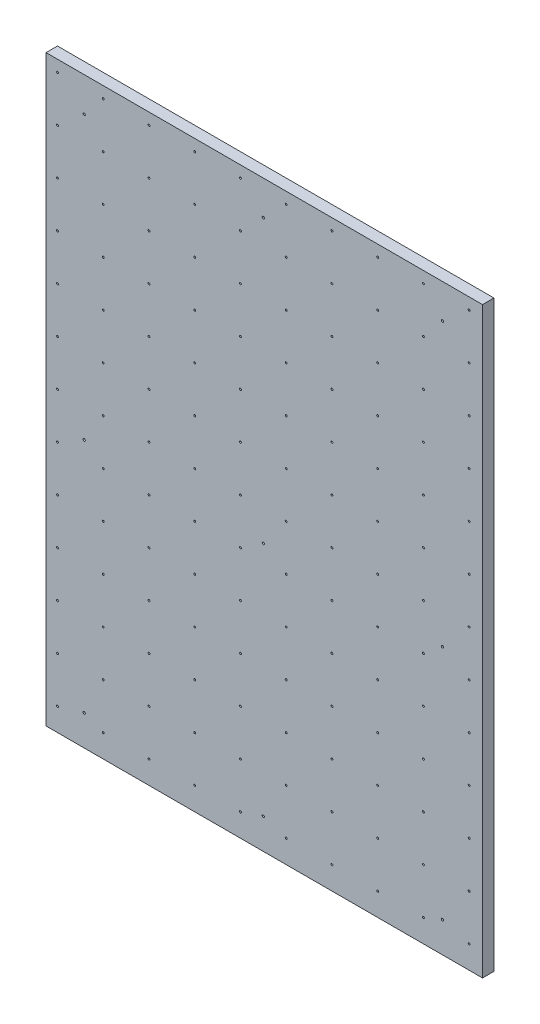
from build123d import *

# Parameters (mm, degrees)
SKETCH_1_W          = 1145
SKETCH_1_H          = 1530
EXTRUDE_1_DEPTH     = 15
SKETCH_2_R          = 2.5
CUT_EXTRUDE_1_DEPTH = 956.971364634
SKETCH_3_R          = 3
CUT_EXTRUDE_2_DEPTH = 956.971364634


with BuildPart() as part:
    # Эскиз1 → Бобышка-Вытянуть1 (new, symmetric)
    with BuildSketch(Plane.XY):
        Rectangle(SKETCH_1_W, SKETCH_1_H)
    extrude(amount=EXTRUDE_1_DEPTH, both=True)

    # Эскиз2 → Вырез-Вытянуть1 (cut, through all)
    with BuildSketch(Plane.XY.offset(15)):
        with Locations((-542.5, 735)):
            Circle(SKETCH_2_R)
        with Locations((-422.5, 735)):
            Circle(SKETCH_2_R)
        with Locations((-302.5, 735)):
            Circle(SKETCH_2_R)
        with Locations((-182.5, 735)):
            Circle(SKETCH_2_R)
        with Locations((-62.5, 735)):
            Circle(SKETCH_2_R)
        with Locations((57.5, 735)):
            Circle(SKETCH_2_R)
        with Locations((177.5, 735)):
            Circle(SKETCH_2_R)
        with Locations((297.5, 735)):
            Circle(SKETCH_2_R)
        with Locations((417.5, 735)):
            Circle(SKETCH_2_R)
        with Locations((537.5, 735)):
            Circle(SKETCH_2_R)
        with Locations((-422.5, 615)):
            Circle(SKETCH_2_R)
        with Locations((-302.5, 615)):
            Circle(SKETCH_2_R)
        with Locations((-182.5, 615)):
            Circle(SKETCH_2_R)
        with Locations((-62.5, 615)):
            Circle(SKETCH_2_R)
        with Locations((57.5, 615)):
            Circle(SKETCH_2_R)
        with Locations((177.5, 615)):
            Circle(SKETCH_2_R)
        with Locations((297.5, 615)):
            Circle(SKETCH_2_R)
        with Locations((417.5, 615)):
            Circle(SKETCH_2_R)
        with Locations((537.5, 615)):
            Circle(SKETCH_2_R)
        with Locations((-422.5, 495)):
            Circle(SKETCH_2_R)
        with Locations((-302.5, 495)):
            Circle(SKETCH_2_R)
        with Locations((-182.5, 495)):
            Circle(SKETCH_2_R)
        with Locations((-62.5, 495)):
            Circle(SKETCH_2_R)
        with Locations((57.5, 495)):
            Circle(SKETCH_2_R)
        with Locations((177.5, 495)):
            Circle(SKETCH_2_R)
        with Locations((297.5, 495)):
            Circle(SKETCH_2_R)
        with Locations((417.5, 495)):
            Circle(SKETCH_2_R)
        with Locations((537.5, 495)):
            Circle(SKETCH_2_R)
        with Locations((-422.5, 375)):
            Circle(SKETCH_2_R)
        with Locations((-302.5, 375)):
            Circle(SKETCH_2_R)
        with Locations((-182.5, 375)):
            Circle(SKETCH_2_R)
        with Locations((-62.5, 375)):
            Circle(SKETCH_2_R)
        with Locations((57.5, 375)):
            Circle(SKETCH_2_R)
        with Locations((177.5, 375)):
            Circle(SKETCH_2_R)
        with Locations((297.5, 375)):
            Circle(SKETCH_2_R)
        with Locations((417.5, 375)):
            Circle(SKETCH_2_R)
        with Locations((537.5, 375)):
            Circle(SKETCH_2_R)
        with Locations((-422.5, 255)):
            Circle(SKETCH_2_R)
        with Locations((-302.5, 255)):
            Circle(SKETCH_2_R)
        with Locations((-182.5, 255)):
            Circle(SKETCH_2_R)
        with Locations((-62.5, 255)):
            Circle(SKETCH_2_R)
        with Locations((57.5, 255)):
            Circle(SKETCH_2_R)
        with Locations((177.5, 255)):
            Circle(SKETCH_2_R)
        with Locations((297.5, 255)):
            Circle(SKETCH_2_R)
        with Locations((417.5, 255)):
            Circle(SKETCH_2_R)
        with Locations((537.5, 255)):
            Circle(SKETCH_2_R)
        with Locations((-422.5, 135)):
            Circle(SKETCH_2_R)
        with Locations((-302.5, 135)):
            Circle(SKETCH_2_R)
        with Locations((-182.5, 135)):
            Circle(SKETCH_2_R)
        with Locations((-62.5, 135)):
            Circle(SKETCH_2_R)
        with Locations((57.5, 135)):
            Circle(SKETCH_2_R)
        with Locations((177.5, 135)):
            Circle(SKETCH_2_R)
        with Locations((297.5, 135)):
            Circle(SKETCH_2_R)
        with Locations((417.5, 135)):
            Circle(SKETCH_2_R)
        with Locations((537.5, 135)):
            Circle(SKETCH_2_R)
        with Locations((-422.5, 15)):
            Circle(SKETCH_2_R)
        with Locations((-302.5, 15)):
            Circle(SKETCH_2_R)
        with Locations((-182.5, 15)):
            Circle(SKETCH_2_R)
        with Locations((-62.5, 15)):
            Circle(SKETCH_2_R)
        with Locations((57.5, 15)):
            Circle(SKETCH_2_R)
        with Locations((177.5, 15)):
            Circle(SKETCH_2_R)
        with Locations((297.5, 15)):
            Circle(SKETCH_2_R)
        with Locations((417.5, 15)):
            Circle(SKETCH_2_R)
        with Locations((537.5, 15)):
            Circle(SKETCH_2_R)
        with Locations((-422.5, -105)):
            Circle(SKETCH_2_R)
        with Locations((-302.5, -105)):
            Circle(SKETCH_2_R)
        with Locations((-182.5, -105)):
            Circle(SKETCH_2_R)
        with Locations((-62.5, -105)):
            Circle(SKETCH_2_R)
        with Locations((57.5, -105)):
            Circle(SKETCH_2_R)
        with Locations((177.5, -105)):
            Circle(SKETCH_2_R)
        with Locations((297.5, -105)):
            Circle(SKETCH_2_R)
        with Locations((417.5, -105)):
            Circle(SKETCH_2_R)
        with Locations((537.5, -105)):
            Circle(SKETCH_2_R)
        with Locations((-422.5, -225)):
            Circle(SKETCH_2_R)
        with Locations((-302.5, -225)):
            Circle(SKETCH_2_R)
        with Locations((-182.5, -225)):
            Circle(SKETCH_2_R)
        with Locations((-62.5, -225)):
            Circle(SKETCH_2_R)
        with Locations((57.5, -225)):
            Circle(SKETCH_2_R)
        with Locations((177.5, -225)):
            Circle(SKETCH_2_R)
        with Locations((297.5, -225)):
            Circle(SKETCH_2_R)
        with Locations((417.5, -225)):
            Circle(SKETCH_2_R)
        with Locations((537.5, -225)):
            Circle(SKETCH_2_R)
        with Locations((-422.5, -345)):
            Circle(SKETCH_2_R)
        with Locations((-302.5, -345)):
            Circle(SKETCH_2_R)
        with Locations((-182.5, -345)):
            Circle(SKETCH_2_R)
        with Locations((-62.5, -345)):
            Circle(SKETCH_2_R)
        with Locations((57.5, -345)):
            Circle(SKETCH_2_R)
        with Locations((177.5, -345)):
            Circle(SKETCH_2_R)
        with Locations((297.5, -345)):
            Circle(SKETCH_2_R)
        with Locations((417.5, -345)):
            Circle(SKETCH_2_R)
        with Locations((537.5, -345)):
            Circle(SKETCH_2_R)
        with Locations((-422.5, -465)):
            Circle(SKETCH_2_R)
        with Locations((-302.5, -465)):
            Circle(SKETCH_2_R)
        with Locations((-182.5, -465)):
            Circle(SKETCH_2_R)
        with Locations((-62.5, -465)):
            Circle(SKETCH_2_R)
        with Locations((57.5, -465)):
            Circle(SKETCH_2_R)
        with Locations((177.5, -465)):
            Circle(SKETCH_2_R)
        with Locations((297.5, -465)):
            Circle(SKETCH_2_R)
        with Locations((417.5, -465)):
            Circle(SKETCH_2_R)
        with Locations((537.5, -465)):
            Circle(SKETCH_2_R)
        with Locations((-422.5, -585)):
            Circle(SKETCH_2_R)
        with Locations((-302.5, -585)):
            Circle(SKETCH_2_R)
        with Locations((-182.5, -585)):
            Circle(SKETCH_2_R)
        with Locations((-62.5, -585)):
            Circle(SKETCH_2_R)
        with Locations((57.5, -585)):
            Circle(SKETCH_2_R)
        with Locations((177.5, -585)):
            Circle(SKETCH_2_R)
        with Locations((297.5, -585)):
            Circle(SKETCH_2_R)
        with Locations((417.5, -585)):
            Circle(SKETCH_2_R)
        with Locations((537.5, -585)):
            Circle(SKETCH_2_R)
        with Locations((-422.5, -705)):
            Circle(SKETCH_2_R)
        with Locations((-302.5, -705)):
            Circle(SKETCH_2_R)
        with Locations((-182.5, -705)):
            Circle(SKETCH_2_R)
        with Locations((-62.5, -705)):
            Circle(SKETCH_2_R)
        with Locations((57.5, -705)):
            Circle(SKETCH_2_R)
        with Locations((177.5, -705)):
            Circle(SKETCH_2_R)
        with Locations((297.5, -705)):
            Circle(SKETCH_2_R)
        with Locations((417.5, -705)):
            Circle(SKETCH_2_R)
        with Locations((537.5, -705)):
            Circle(SKETCH_2_R)
        with Locations((-542.5, 615)):
            Circle(SKETCH_2_R)
        with Locations((-542.5, 495)):
            Circle(SKETCH_2_R)
        with Locations((-542.5, 375)):
            Circle(SKETCH_2_R)
        with Locations((-542.5, 255)):
            Circle(SKETCH_2_R)
        with Locations((-542.5, 135)):
            Circle(SKETCH_2_R)
        with Locations((-542.5, 15)):
            Circle(SKETCH_2_R)
        with Locations((-542.5, -105)):
            Circle(SKETCH_2_R)
        with Locations((-542.5, -225)):
            Circle(SKETCH_2_R)
        with Locations((-542.5, -345)):
            Circle(SKETCH_2_R)
        with Locations((-542.5, -465)):
            Circle(SKETCH_2_R)
        with Locations((-542.5, -585)):
            Circle(SKETCH_2_R)
        with Locations((-542.5, -705)):
            Circle(SKETCH_2_R)
    extrude(amount=-CUT_EXTRUDE_1_DEPTH, mode=Mode.SUBTRACT)

    # Эскиз3 → Вырез-Вытянуть2 (cut, through all)
    with BuildSketch(Plane.XY.offset(15)):
        with Locations((467.5, -685)):
            Circle(SKETCH_3_R)
        with Locations((-2.5, -685)):
            Circle(SKETCH_3_R)
        with Locations((-472.5, -685)):
            Circle(SKETCH_3_R)
        with Locations((-472.5, -65)):
            Circle(SKETCH_3_R)
        with Locations((-2.5, -65)):
            Circle(SKETCH_3_R)
        with Locations((467.5, -65)):
            Circle(SKETCH_3_R)
        with Locations((467.5, 675)):
            Circle(SKETCH_3_R)
        with Locations((-2.5, 675)):
            Circle(SKETCH_3_R)
        with Locations((-472.5, 675)):
            Circle(SKETCH_3_R)
    extrude(amount=-CUT_EXTRUDE_2_DEPTH, mode=Mode.SUBTRACT)


solid = part.part
